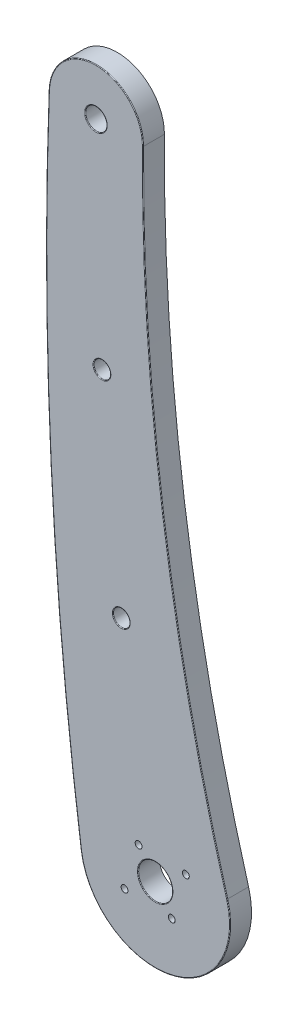
from build123d import *

# Parameters (mm, degrees)
SKETCH2_R                  = 2.5
SKETCH2_R_2                = 4
BOSS_EXTRUDE1_DEPTH        = 5
M3_5_CLEARANCE_HOLE1_D     = 3.9
M3_5_CLEARANCE_HOLE1_DEPTH = 10
M3_5_CLEARANCE_HOLE1_TIP   = 1.171678207
FILLET1_R                  = 0.15
SKETCH8_R                  = 0.8
CUT_EXTRUDE1_DEPTH         = 221.769273329


with BuildPart() as part:
    # Sketch2 → Boss-Extrude1 (new body)
    with BuildSketch(Plane.XY):
        with BuildLine():
            ThreePointArc((-23.070308625, 204.852776014), (-18.384568366, 132.936409066), (-3.408597018, 62.440733462))
            ThreePointArc((-3.408597018, 62.440733462), (-16.572041078, 40.464439954), (-37.552346237, 55.163437582))
            ThreePointArc((-37.552346237, 55.163437582), (-44.635045584, 130.092922622), (-45.061833099, 205.355198769))
            ThreePointArc((-45.061833099, 205.355198769), (-33.818791234, 215.927653179), (-23.070308625, 204.852776014))
        make_face()
        with Locations((-34.070033869, 204.930522774)):
            Circle(SKETCH2_R, mode=Mode.SUBTRACT)
        with Locations((-20.22, 57.58)):
            Circle(SKETCH2_R_2, mode=Mode.SUBTRACT)
    extrude(amount=-BOSS_EXTRUDE1_DEPTH)

    # M3.5 Clearance Hole1
    with Locations(Plane.XY):
        with Locations((-32.658696908, 154.950445464), (-28.146734226, 106.947670438)):
            Hole(M3_5_CLEARANCE_HOLE1_D / 2, depth=M3_5_CLEARANCE_HOLE1_DEPTH)
            with Locations((0, 0, -(M3_5_CLEARANCE_HOLE1_DEPTH + M3_5_CLEARANCE_HOLE1_TIP / 2))):  # 118° drill point
                Cone(0, M3_5_CLEARANCE_HOLE1_D / 2, M3_5_CLEARANCE_HOLE1_TIP, mode=Mode.SUBTRACT)

    # Fillet1
    fillet1_edges = [part.edges().sort_by_distance(p)[0] for p in [
        (-36.570033869, 204.930522774, 0),
        (-24.22, 57.58, 0),
        (-26.196734226, 106.947670438, 0),
        (-30.708696908, 154.950445464, 0),
        (-18.384568366, 132.936409066, 0),
        (-16.572041078, 40.464439954, 0),
        (-44.635045584, 130.092922622, 0),
        (-33.818791234, 215.927653179, 0),
    ]]
    fillet(fillet1_edges, radius=FILLET1_R)

    # Sketch8 → Cut-Extrude1 (cut, through all)
    with BuildSketch(Plane.XY):
        with Locations((-27.383509966, 52.555398028)):
            Circle(SKETCH8_R)
        with Locations((-16.343878479, 52.053863741)):
            Circle(SKETCH8_R)
        with Locations((-13.056490034, 62.604601972)):
            Circle(SKETCH8_R)
        with Locations((-24.096121521, 63.106136259)):
            Circle(SKETCH8_R)
    extrude(amount=-CUT_EXTRUDE1_DEPTH, mode=Mode.SUBTRACT)


solid = part.part
